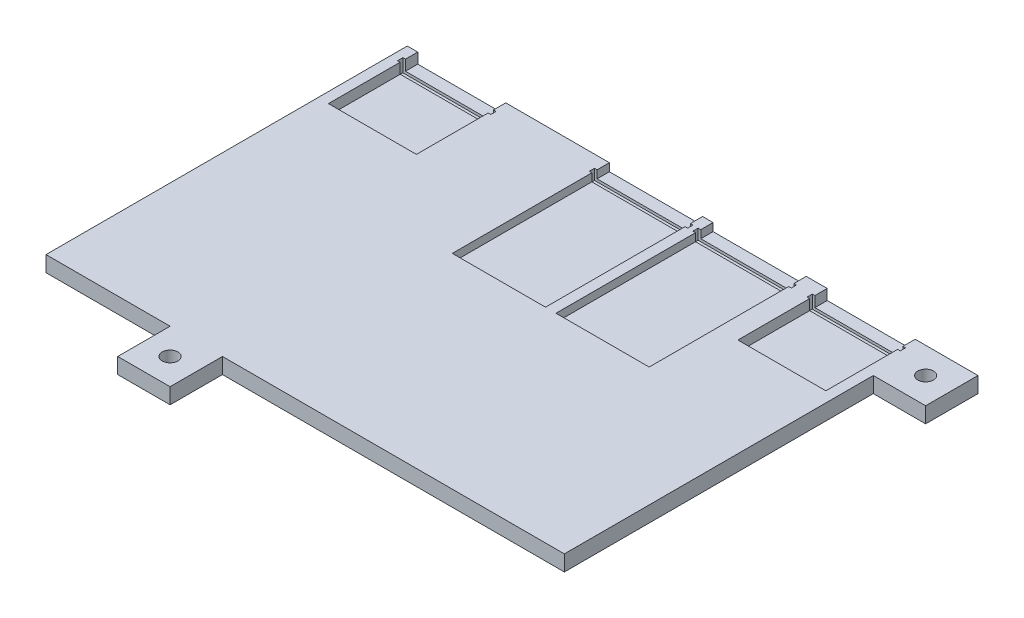
from build123d import *

# Parameters (mm, degrees)
SKETCH1_W           = 99
SKETCH1_H           = 69
BOSS_EXTRUDE1_DEPTH = 3
CUT_EXTRUDE1_DEPTH  = 2
SKETCH6_W           = 0.5
SKETCH6_H           = 1
CUT_EXTRUDE3_DEPTH  = 2
SKETCH5_W           = 17.8
SKETCH5_H           = 1
CUT_EXTRUDE2_DEPTH  = 0.5
CUT_EXTRUDE4_DEPTH  = 1.5
SKETCH8_W           = 18.8
SKETCH8_H           = 1
CUT_EXTRUDE5_DEPTH  = 0.5
SKETCH9_W           = 10
SKETCH9_H           = 10
BOSS_EXTRUDE2_DEPTH = 3
SKETCH10_R          = 1.5
CUT_EXTRUDE6_DEPTH  = 3


with BuildPart() as part:
    # Sketch1 → Boss-Extrude1 (new body)
    with BuildSketch(Plane(origin=(0, 0, 0), x_dir=(1, 0, 0), z_dir=(0, 1, 0))):
        Rectangle(SKETCH1_W, SKETCH1_H)
    extrude(amount=BOSS_EXTRUDE1_DEPTH)

    # Sketch4 → Cut-Extrude1 (cut)
    with BuildSketch(Plane(origin=(0, 3, 0), x_dir=(1, 0, 0), z_dir=(0, 1, 0))):
        Polygon((47.5, 31.149720819), (47.5, 17.443513176), (30.7, 17.443513176), (30.7, 31.149720819), (30.7, 34.5), (47.5, 34.5), align=None)
        Polygon((-47.5, 17.443513176), (-47.5, 31.149720819), (-47.5, 34.5), (-30.7, 34.5), (-30.7, 31.149720819), (-30.7, 17.443513176), align=None)
    extrude(amount=-CUT_EXTRUDE1_DEPTH, mode=Mode.SUBTRACT)

    # Sketch6 → Cut-Extrude3 (cut)
    with BuildSketch(Plane(origin=(0, 1, 0), x_dir=(1, 0, 0), z_dir=(0, 1, 0))):
        with Locations((-47.75, 31.649720819)):
            Rectangle(SKETCH6_W, SKETCH6_H)
        with Locations((-30.45, 31.649720819)):
            Rectangle(SKETCH6_W, SKETCH6_H)
        with Locations((47.75, 31.649720819)):
            Rectangle(SKETCH6_W, SKETCH6_H)
        with Locations((30.45, 31.649720819)):
            Rectangle(SKETCH6_W, SKETCH6_H)
    extrude(amount=CUT_EXTRUDE3_DEPTH, mode=Mode.SUBTRACT)

    # Sketch5 → Cut-Extrude2 (cut)
    with BuildSketch(Plane(origin=(0, 1, 0), x_dir=(1, 0, 0), z_dir=(0, 1, 0))):
        with Locations((39.1, 31.649720819)):
            Rectangle(SKETCH5_W, SKETCH5_H)
        with Locations((-39.1, 31.649720819)):
            Rectangle(SKETCH5_W, SKETCH5_H)
    extrude(amount=-CUT_EXTRUDE2_DEPTH, mode=Mode.SUBTRACT)

    # Sketch7 → Cut-Extrude4 (cut)
    with BuildSketch(Plane(origin=(0, 3, 0), x_dir=(1, 0, 0), z_dir=(0, 1, 0))):
        Polygon((-10.9, 31.149720819), (-10.9, 4.5), (6.9, 4.5), (6.9, 31.149720819), (7.4, 31.149720819), (7.4, 32.149720819), (6.9, 32.149720819), (6.9, 34.5), (-10.9, 34.5), (-10.9, 32.149720819), (-11.4, 32.149720819), (-11.4, 31.149720819), align=None)
        Polygon((8.9, 34.5), (26.7, 34.5), (26.7, 32.149720819), (27.2, 32.149720819), (27.2, 31.149720819), (26.7, 31.149720819), (26.7, 4.5), (8.9, 4.5), (8.9, 31.149720819), (8.4, 31.149720819), (8.4, 32.149720819), (8.9, 32.149720819), align=None)
    extrude(amount=-CUT_EXTRUDE4_DEPTH, mode=Mode.SUBTRACT)

    # Sketch8 → Cut-Extrude5 (cut)
    with BuildSketch(Plane(origin=(0, 1.5, 0), x_dir=(1, 0, 0), z_dir=(0, 1, 0))):
        with Locations((-2, 31.649720819)):
            Rectangle(SKETCH8_W, SKETCH8_H)
        with Locations((17.8, 31.649720819)):
            Rectangle(SKETCH8_W, SKETCH8_H)
    extrude(amount=-CUT_EXTRUDE5_DEPTH, mode=Mode.SUBTRACT)

    # Sketch9 → Boss-Extrude2 (add)
    with BuildSketch(Plane.XZ):
        with Locations((-20.8, 39.5)):
            Rectangle(SKETCH9_W, SKETCH9_H)
        with Locations((54.5, -29.5)):
            Rectangle(SKETCH9_W, SKETCH9_H)
    extrude(amount=-BOSS_EXTRUDE2_DEPTH)

    # Sketch10 → Cut-Extrude6 (cut)
    with BuildSketch(Plane(origin=(0, 3, 0), x_dir=(1, 0, 0), z_dir=(0, 1, 0))):
        with Locations(Location((-20.8, -39.5, 0), (0, 0, 270))):
            Circle(SKETCH10_R)
        with Locations(Location((54.5, 29.5, 0), (0, 0, 270))):
            Circle(SKETCH10_R)
    extrude(amount=-CUT_EXTRUDE6_DEPTH, mode=Mode.SUBTRACT)


solid = part.part
